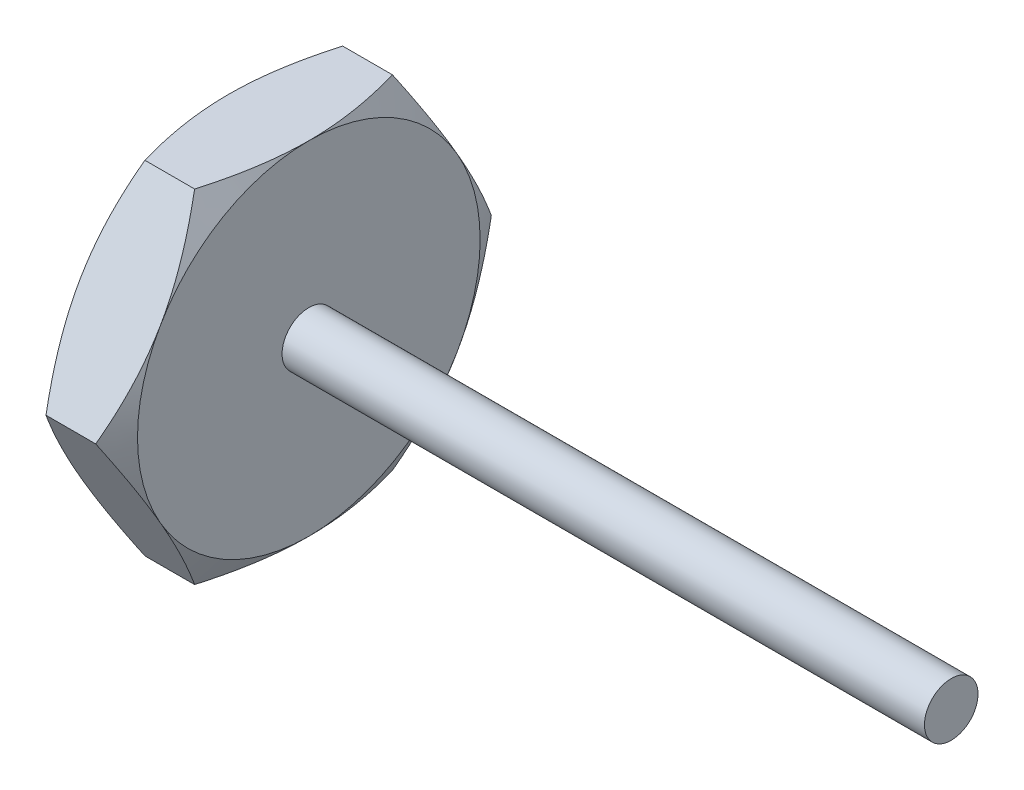
from build123d import *

# Parameters (mm, degrees)
Y_KSEKLIK_EKSTR_ZYON1_DEPTH = 3.75
IZIM2_R                     = 1.25
Y_KSEKLIK_EKSTR_ZYON2_DEPTH = 30
IZIM3_OUTSIDE_W             = 63.452
IZIM3_OUTSIDE_H             = 60.976
IZIM3_OUTSIDE_R             = 8
KES_EKSTR_ZYON1_DEPTH       = 10
KES_EKSTR_ZYON1_DRAFT       = -60
IZIM4_OUTSIDE_W             = 63.452
IZIM4_OUTSIDE_H             = 60.976
IZIM4_OUTSIDE_R             = 8
KES_EKSTR_ZYON2_DEPTH       = 10
KES_EKSTR_ZYON2_DRAFT       = -60


with BuildPart() as part:
    # Çizim1 → Yükseklik-Ekstrüzyon1 (new body)
    with BuildSketch(Plane(origin=(0, 0, 0), x_dir=(0, 0, -1), z_dir=(1, 0, 0))):
        Polygon((-6.225342033, 7.865351493), (-10.844144187, 15.865351493), (-20.081748494, 15.865351493), (-24.700550647, 7.865351493), (-20.081748494, -0.134648507), (-10.844144187, -0.134648507), align=None)
    extrude(amount=Y_KSEKLIK_EKSTR_ZYON1_DEPTH)

    # Çizim2 → Yükseklik-Ekstrüzyon2 (add)
    with BuildSketch(Plane(origin=(3.75, 0, 0), x_dir=(0, 0, -1), z_dir=(1, 0, 0))):
        with Locations((-15.46294634, 7.865351493)):
            Circle(IZIM2_R)
    extrude(amount=Y_KSEKLIK_EKSTR_ZYON2_DEPTH)


with BuildPart() as kes_ekstr_zyon1_tool:
    # Çizim3 outside → Kes-Ekstrüzyon1 (with draft: the straight prism first)
    with BuildSketch(Plane.ZY):
        with Locations((15.463, 7.865)):
            Rectangle(IZIM3_OUTSIDE_W, IZIM3_OUTSIDE_H)
        with Locations((15.46294634, 7.865351493)):
            Circle(IZIM3_OUTSIDE_R, mode=Mode.SUBTRACT)
    extrude(amount=-KES_EKSTR_ZYON1_DEPTH)
    # Kes-Ekstrüzyon1: the draft: its side faces are tilted about the plane it starts from
    kes_ekstr_zyon1_sides = [kes_ekstr_zyon1_tool.faces().sort_by_distance(p)[0] for p in [
        (5, -22.623, 15.463),
        (5, 7.865, 47.189),
        (5, 38.353, 15.463),
        (5, 7.865, -16.263),
        (5, 7.865351493, 7.46294634),
    ]]
    draft(kes_ekstr_zyon1_sides, Plane.ZY, KES_EKSTR_ZYON1_DRAFT)


with BuildPart() as part_1:
    add(part.part)

    # Kes-Ekstrüzyon1: cut by kes_ekstr_zyon1_tool
    add(kes_ekstr_zyon1_tool.part, mode=Mode.SUBTRACT)


with BuildPart() as kes_ekstr_zyon2_tool:
    # Çizim4 outside → Kes-Ekstrüzyon2 (with draft: the straight prism first)
    with BuildSketch(Plane(origin=(3.75, 0, 0), x_dir=(0, 0, -1), z_dir=(1, 0, 0))):
        with Locations((-15.463, 7.865)):
            Rectangle(IZIM4_OUTSIDE_W, IZIM4_OUTSIDE_H)
        with Locations((-15.46294634, 7.865351493)):
            Circle(IZIM4_OUTSIDE_R, mode=Mode.SUBTRACT)
    extrude(amount=-KES_EKSTR_ZYON2_DEPTH)
    # Kes-Ekstrüzyon2: the draft: its side faces are tilted about the plane it starts from
    kes_ekstr_zyon2_sides = [kes_ekstr_zyon2_tool.faces().sort_by_distance(p)[0] for p in [
        (-1.25, -22.623, 15.463),
        (-1.25, 7.865, -16.263),
        (-1.25, 38.353, 15.463),
        (-1.25, 7.865, 47.189),
        (-1.25, 7.865351493, 23.46294634),
    ]]
    draft(kes_ekstr_zyon2_sides, Plane(origin=(3.75, 0, 0), x_dir=(0, 0, -1), z_dir=(1, 0, 0)), KES_EKSTR_ZYON2_DRAFT)


with BuildPart() as part_2:
    add(part_1.part)

    # Kes-Ekstrüzyon2: cut by kes_ekstr_zyon2_tool
    add(kes_ekstr_zyon2_tool.part, mode=Mode.SUBTRACT)


solid = part_2.part
